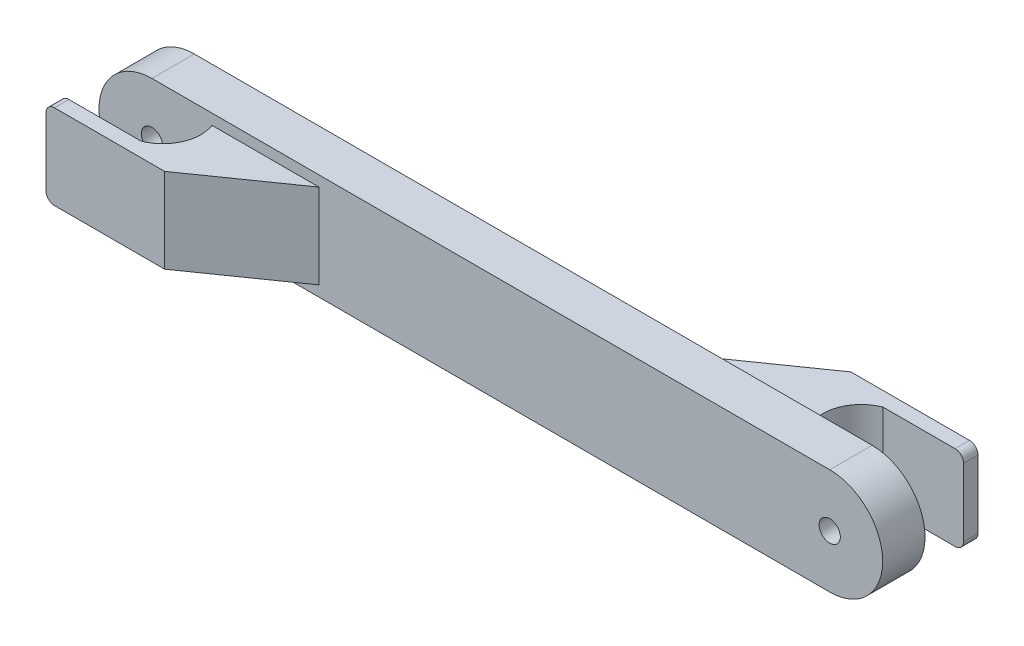
from build123d import *

# Parameters (mm, degrees)
SKETCH1_R           = 3.175
BOSS_EXTRUDE1_DEPTH = 12.7
BOSS_EXTRUDE2_DEPTH = 19.05
CUT_EXTRUDE2_DEPTH  = 30.48
BOSS_EXTRUDE7_DEPTH = 25.4
BOSS_EXTRUDE8_DEPTH = 19.05
CUT_EXTRUDE3_DEPTH  = 41.148
BOSS_EXTRUDE9_DEPTH = 25.4


with BuildPart() as part:
    # Sketch1 → Boss-Extrude1 (new body)
    with BuildSketch(Plane.XY):
        with BuildLine():
            Line((299.870251741, -63.185614448), (503.070251741, -63.185614448))
            ThreePointArc((503.070251741, -63.185614448), (518.945251741, -79.060614448), (503.070251741, -94.935614448))
            Line((503.070251741, -94.935614448), (299.870251741, -94.935614448))
            ThreePointArc((299.870251741, -94.935614448), (283.995251741, -79.060614448), (299.870251741, -63.185614448))
        make_face()
        with Locations((299.870251741, -79.060614448)):
            Circle(SKETCH1_R, mode=Mode.SUBTRACT)
        with Locations((503.070251741, -79.060614448)):
            Circle(SKETCH1_R, mode=Mode.SUBTRACT)
    extrude(amount=BOSS_EXTRUDE1_DEPTH)

    # Sketch2 → Boss-Extrude2 (add)
    with BuildSketch(Plane(origin=(0, 0, 0), x_dir=(-1, 0, 0), z_dir=(0, 0, -1))):
        with BuildLine():
            Line((-477.670251741, -66.360614448), (-477.670251741, -91.760614448))
            Line((-477.670251741, -91.760614448), (-513.230251741, -91.760614448))
            ThreePointArc((-513.230251741, -91.760614448), (-515.026302965, -91.016665672), (-515.770251741, -89.220614448))
            Line((-515.770251741, -89.220614448), (-515.770251741, -68.900614448))
            ThreePointArc((-515.770251741, -68.900614448), (-515.026302965, -67.104563223), (-513.230251741, -66.360614448))
            Line((-513.230251741, -66.360614448), (-477.670251741, -66.360614448))
        make_face()
    extrude(amount=BOSS_EXTRUDE2_DEPTH)

    # Sketch6 → Cut-Extrude2 (cut)
    with BuildSketch(Plane.XZ.offset(91.760614448)):
        with BuildLine():
            Line((499.246061033, 0), (515.770251741, 0))
            Line((515.770251741, 0), (515.770251741, -14.733462418))
            Line((515.770251741, -14.733462418), (491.640251741, -14.733462418))
            ThreePointArc((491.640251741, -14.733462418), (485.287193282, -8.73432293), (485.036934778, 0))
            Line((485.036934778, 0), (488.908392954, 0))
            Line((488.908392954, 0), (499.246061033, 0))
        make_face()
    extrude(amount=-CUT_EXTRUDE2_DEPTH, mode=Mode.SUBTRACT)

    # Sketch4 → Boss-Extrude7 (add)
    with BuildSketch(Plane.XZ.offset(91.760614448)):
        Polygon((477.670251741, -19.05), (450.464032212, 0), (477.670251741, 0), align=None)
    extrude(amount=-BOSS_EXTRUDE7_DEPTH)

    # Sketch7 → Boss-Extrude8 (add)
    with BuildSketch(Plane.XY.offset(12.7)):
        with BuildLine():
            Line((310.030251741, -66.360614448), (312.570251741, -66.360614448))
            Line((312.570251741, -66.360614448), (322.730251741, -66.360614448))
            Line((322.730251741, -66.360614448), (322.730251741, -91.760614448))
            Line((322.730251741, -91.760614448), (310.030251741, -91.760614448))
            Line((310.030251741, -91.760614448), (289.710251741, -91.760614448))
            ThreePointArc((289.710251741, -91.760614448), (287.914200517, -91.016665672), (287.170251741, -89.220614448))
            Line((287.170251741, -89.220614448), (287.170251741, -68.900614448))
            ThreePointArc((287.170251741, -68.900614448), (287.914200517, -67.104563223), (289.710251741, -66.360614448))
            Line((289.710251741, -66.360614448), (310.030251741, -66.360614448))
        make_face()
    extrude(amount=BOSS_EXTRUDE8_DEPTH)

    # Sketch8 → Cut-Extrude3 (cut)
    with BuildSketch(Plane(origin=(0, -66.360614448, 0), x_dir=(1, 0, 0), z_dir=(0, 1, 0))):
        with BuildLine():
            Line((287.170251741, -12.7), (317.904251741, -12.7))
            ThreePointArc((317.904251741, -12.7), (317.648023156, -21.431345807), (311.300251741, -27.432))
            Line((311.300251741, -27.432), (287.170251741, -27.432))
            Line((287.170251741, -27.432), (287.170251741, -12.7))
        make_face()
    extrude(amount=-CUT_EXTRUDE3_DEPTH, mode=Mode.SUBTRACT)

    # Sketch9 → Boss-Extrude9 (add)
    with BuildSketch(Plane(origin=(0, -66.360614448, 0), x_dir=(1, 0, 0), z_dir=(0, 1, 0))):
        Polygon((322.730251741, -31.75), (349.936471269, -12.7), (322.730251741, -12.7), align=None)
    extrude(amount=-BOSS_EXTRUDE9_DEPTH)


solid = part.part
